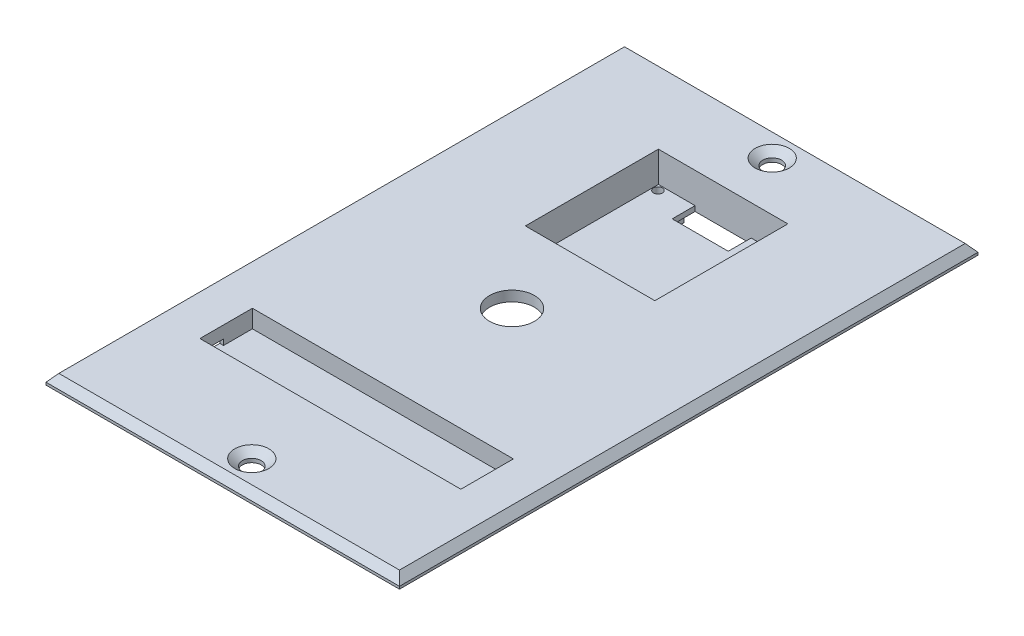
from build123d import *
from OCP.BRepFilletAPI import BRepFilletAPI_MakeChamfer

# Parameters (mm, degrees)
SKETCH2_W                = 69.35
SKETCH2_H                = 113.5
SKETCH2_R                = 1.85
BOSS_EXTRUDE3_DEPTH      = 2
SKETCH4_W                = 25.4
SKETCH4_H                = 26.1
CUT_EXTRUDE7_DEPTH       = 7.5
SKETCH16_W               = 29.414133621
SKETCH16_H               = 29.490350257
BOSS_EXTRUDE18_DEPTH     = 5
SKETCH17_W               = 25.4
SKETCH17_H               = 26.1
CUT_EXTRUDE8_DEPTH       = 4
SKETCH18_W               = 5
SKETCH18_H               = 5
BOSS_EXTRUDE24_DEPTH     = 4
SKETCH20_R               = 0.875
CUT_EXTRUDE10_DEPTH      = 4
SKETCH24_W               = 11
SKETCH24_H               = 4.5
CUT_EXTRUDE11_DEPTH      = 4
CHAMFER1_SIZE            = 1.5
CHAMFER1_SIZE2           = 1.258649447
SKETCH25_R               = 4.4
CUT_EXTRUDE12_DEPTH      = 4
SKETCH26_W               = 51.2
SKETCH26_H               = 10.3
CUT_EXTRUDE13_DEPTH      = 4
SKETCH27_W               = 52.651978828
SKETCH27_H               = 11.660574528
BOSS_EXTRUDE30_DEPTH     = 3
SKETCH30_W               = 51.2
SKETCH30_H               = 10.3
CUT_EXTRUDE14_DEPTH      = 3
SKETCH31_W               = 51.2
SKETCH31_H               = 10.3
BOSS_EXTRUDE31_DEPTH     = 1.5
SKETCH32_W               = 11.249454003
SKETCH32_H               = 2.603694337
CUT_EXTRUDE15_DEPTH      = 1.5
SKETCH33_W               = 1.5
SKETCH33_H               = 11.249454003
CUT_EXTRUDE16_DEPTH      = 1.5
SKETCH34_R               = 0.991075147
CUT_EXTRUDE17_DEPTH      = 1.5
SKETCH35_W               = 4.49763683
SKETCH35_H               = 1.113144729
CUT_EXTRUDE18_DEPTH      = 1.5
SKETCH36_W               = 62.277737466
SKETCH36_H               = 15.843958398
CUT_EXTRUDE19_DEPTH      = 0.5
SKETCH37_W               = 13.804637021
SKETCH37_H               = 39.531460558
CUT_EXTRUDE22_DEPTH      = 0.5
CHAMFER2_SIZE            = 1.5
CHAMFER2_SIZE2           = 1.258649447
CHAMFER3_SIZE            = 1.5
CHAMFER3_SIZE2           = 1.258649447
CUT_EXTRUDE23_DEPTH      = 67.821913509
CUT_EXTRUDE23_DEPTH_BACK = 67.821913509
SKETCH42_R               = 0.875


with BuildPart() as part:
    # Sketch2 → Boss-Extrude3 (new body)
    with BuildSketch(Plane(origin=(0, 0, 0), x_dir=(1, 0, 0), z_dir=(0, 1, 0))):
        Rectangle(SKETCH2_W, SKETCH2_H)
        with Locations(Location((0, 51.050462441, 0), (0, 0, 270))):
            Circle(SKETCH2_R, mode=Mode.SUBTRACT)
        with Locations(Location((0, -51.050462441, 0), (0, 0, 90))):
            Circle(SKETCH2_R, mode=Mode.SUBTRACT)
    extrude(amount=BOSS_EXTRUDE3_DEPTH)

    # Sketch4 → Cut-Extrude7 (cut)
    with BuildSketch(Plane(origin=(0, 2, 0), x_dir=(1, 0, 0), z_dir=(0, 1, 0))):
        with Locations((0, 28.375)):
            Rectangle(SKETCH4_W, SKETCH4_H)
    extrude(amount=-CUT_EXTRUDE7_DEPTH, mode=Mode.SUBTRACT)

    # Sketch16 → Boss-Extrude18 (add)
    with BuildSketch(Plane(origin=(0, 0, 0), x_dir=(-1, 0, 0), z_dir=(0, -1, 0))):
        with Locations((-0.116069165, 28.233366211)):
            Rectangle(SKETCH16_W, SKETCH16_H)
    extrude(amount=BOSS_EXTRUDE18_DEPTH)

    # Sketch17 → Cut-Extrude8 (cut)
    with BuildSketch(Plane(origin=(0, 0, 0), x_dir=(1, 0, 0), z_dir=(0, 1, 0))):
        with Locations((0, 28.375)):
            Rectangle(SKETCH17_W, SKETCH17_H)
    extrude(amount=-CUT_EXTRUDE8_DEPTH, mode=Mode.SUBTRACT)

    # Sketch18 → Boss-Extrude24 (add)
    with BuildSketch(Plane(origin=(0, -4, 0), x_dir=(1, 0, 0), z_dir=(0, 1, 0))):
        with Locations((-10.2, 38.925)):
            Rectangle(SKETCH18_W, SKETCH18_H)
        with Locations((10.2, 38.925)):
            Rectangle(SKETCH18_W, SKETCH18_H)
        with Locations((10.2, 17.825)):
            Rectangle(SKETCH18_W, SKETCH18_H)
        with Locations((-10.2, 17.825)):
            Rectangle(SKETCH18_W, SKETCH18_H)
    extrude(amount=-BOSS_EXTRUDE24_DEPTH)

    # Sketch20 → Cut-Extrude10 (cut)
    with BuildSketch(Plane(origin=(0, -8, 0), x_dir=(-1, 0, 0), z_dir=(0, -1, 0))):
        with Locations(Location((-11.659970213, 40.369100554, 0), (0, 0, 90))):
            Circle(SKETCH20_R)
        with Locations(Location((11.725608978, 40.361432855, 0), (0, 0, 270))):
            Circle(SKETCH20_R)
        with Locations(Location((11.725608978, 16.657728735, 0), (0, 0, 90))):
            Circle(SKETCH20_R)
        with Locations(Location((-11.659970213, 16.657728735, 0), (0, 0, 270))):
            Circle(SKETCH20_R)
    extrude(amount=-CUT_EXTRUDE10_DEPTH, mode=Mode.SUBTRACT)

    # Sketch24 → Cut-Extrude11 (cut)
    with BuildSketch(Plane(origin=(0, -4, 0), x_dir=(1, 0, 0), z_dir=(0, 1, 0))):
        with Locations((0, 39.175)):
            Rectangle(SKETCH24_W, SKETCH24_H)
    extrude(amount=-CUT_EXTRUDE11_DEPTH, mode=Mode.SUBTRACT)

    # Chamfer1: one chamfer whose edges measure the first distance from different faces: ONE call of the kernel's chamfer builder (chamfer() names one face for all edges)
    chamfer1_edges_1 = [part.edges().sort_by_distance(p)[0] for p in [
        (-34.675, 2, 0),
    ]]
    chamfer1_side_1 = [part.faces().sort_by_distance(p)[0] for p in [
        (-34.675, 1, 0),
    ]]
    chamfer1_edges_2 = [part.edges().sort_by_distance(p)[0] for p in [
        (0, 2, 56.75),
    ]]
    chamfer1_side_2 = [part.faces().sort_by_distance(p)[0] for p in [
        (0, 1, 56.75),
    ]]
    chamfer1_edges_3 = [part.edges().sort_by_distance(p)[0] for p in [
        (34.675, 2, 0),
    ]]
    chamfer1_side_3 = [part.faces().sort_by_distance(p)[0] for p in [
        (34.675, 1, 0),
    ]]
    chamfer1_edges_4 = [part.edges().sort_by_distance(p)[0] for p in [
        (0, 2, -56.75),
    ]]
    chamfer1_side_4 = [part.faces().sort_by_distance(p)[0] for p in [
        (0, 1, -56.75),
    ]]
    chamfer1 = BRepFilletAPI_MakeChamfer(part.part.solid().wrapped)
    for e in chamfer1_edges_1:
        chamfer1.Add(CHAMFER1_SIZE, CHAMFER1_SIZE2, e.wrapped, chamfer1_side_1[0].wrapped)  # the first distance lies on this face
    for e in chamfer1_edges_2:
        chamfer1.Add(CHAMFER1_SIZE, CHAMFER1_SIZE2, e.wrapped, chamfer1_side_2[0].wrapped)  # the first distance lies on this face
    for e in chamfer1_edges_3:
        chamfer1.Add(CHAMFER1_SIZE, CHAMFER1_SIZE2, e.wrapped, chamfer1_side_3[0].wrapped)  # the first distance lies on this face
    for e in chamfer1_edges_4:
        chamfer1.Add(CHAMFER1_SIZE, CHAMFER1_SIZE2, e.wrapped, chamfer1_side_4[0].wrapped)  # the first distance lies on this face
    add(Compound.cast(chamfer1.Shape()), mode=Mode.REPLACE)

    # Sketch25 → Cut-Extrude12 (cut)
    with BuildSketch(Plane(origin=(0, 2, 0), x_dir=(1, 0, 0), z_dir=(0, 1, 0))):
        with Locations(Location((0, 0, 0), (0, 0, 270))):
            Circle(SKETCH25_R)
    extrude(amount=-CUT_EXTRUDE12_DEPTH, mode=Mode.SUBTRACT)

    # Sketch26 → Cut-Extrude13 (cut)
    with BuildSketch(Plane(origin=(0, 2, 0), x_dir=(1, 0, 0), z_dir=(0, 1, 0))):
        with Locations((0.104035738, -30.584770495)):
            Rectangle(SKETCH26_W, SKETCH26_H)
    extrude(amount=-CUT_EXTRUDE13_DEPTH, mode=Mode.SUBTRACT)

    # Sketch27 → Boss-Extrude30 (add)
    with BuildSketch(Plane(origin=(0, 0, 0), x_dir=(-1, 0, 0), z_dir=(0, -1, 0))):
        with Locations((-0.102132054, -30.545281087)):
            Rectangle(SKETCH27_W, SKETCH27_H)
    extrude(amount=BOSS_EXTRUDE30_DEPTH)

    # Sketch30 → Cut-Extrude14 (cut)
    with BuildSketch(Plane(origin=(0, 0, 0), x_dir=(1, 0, 0), z_dir=(0, 1, 0))):
        with Locations((0.104035738, -30.584770495)):
            Rectangle(SKETCH30_W, SKETCH30_H)
    extrude(amount=-CUT_EXTRUDE14_DEPTH, mode=Mode.SUBTRACT)

    # Sketch31 → Boss-Extrude31 (add)
    with BuildSketch(Plane(origin=(0, -3, 0), x_dir=(-1, 0, 0), z_dir=(0, -1, 0))):
        with Locations((-0.104035738, -30.584770495)):
            Rectangle(SKETCH31_W, SKETCH31_H)
    extrude(amount=-BOSS_EXTRUDE31_DEPTH)

    # Sketch32 → Cut-Extrude15 (cut)
    with BuildSketch(Plane(origin=(26.428121468, 0, 0), x_dir=(0, 0, -1), z_dir=(1, 0, 0))):
        with Locations((-30.572653553, -1.487745374)):
            Rectangle(SKETCH32_W, SKETCH32_H)
    extrude(amount=-CUT_EXTRUDE15_DEPTH, mode=Mode.SUBTRACT)

    # Sketch33 → Cut-Extrude16 (cut)
    with BuildSketch(Plane(origin=(0, -2.789592542, 0), x_dir=(1, 0, 0), z_dir=(0, 1, 0))):
        with Locations((25.678121468, -30.572653553)):
            Rectangle(SKETCH33_W, SKETCH33_H)
    extrude(amount=-CUT_EXTRUDE16_DEPTH, mode=Mode.SUBTRACT)

    # Sketch34 → Cut-Extrude17 (cut)
    with BuildSketch(Plane.ZY.offset(26.22385736)):
        with Locations((34.622232322, -1.377930419)):
            Circle(SKETCH34_R)
    extrude(amount=-CUT_EXTRUDE17_DEPTH, mode=Mode.SUBTRACT)

    # Sketch35 → Cut-Extrude18 (cut)
    with BuildSketch(Plane.ZY.offset(26.22385736)):
        with Locations((33.35694274, -0.943427635)):
            Rectangle(SKETCH35_W, SKETCH35_H)
    extrude(amount=-CUT_EXTRUDE18_DEPTH, mode=Mode.SUBTRACT)

    # Sketch36 → Cut-Extrude19 (cut)
    with BuildSketch(Plane(origin=(0, 0, 0), x_dir=(-1, 0, 0), z_dir=(0, -1, 0))):
        with Locations((-0.078435438, -15.373345772)):
            Rectangle(SKETCH36_W, SKETCH36_H)
    extrude(amount=-CUT_EXTRUDE19_DEPTH, mode=Mode.SUBTRACT)

    # Sketch37 → Cut-Extrude22 (cut)
    with BuildSketch(Plane(origin=(0, 0, 0), x_dir=(-1, 0, 0), z_dir=(0, -1, 0))):
        with Locations((-23.687502159, 32.707577485)):
            Rectangle(SKETCH37_W, SKETCH37_H)
    extrude(amount=-CUT_EXTRUDE22_DEPTH, mode=Mode.SUBTRACT)

    # Chamfer2
    chamfer2_edges = [part.edges().sort_by_distance(p)[0] for p in [
        (0, 2, 52.900462441),
    ]]
    chamfer2_side = [part.faces().sort_by_distance(p)[0] for p in [
        (-32.120828655, 2, 0),
    ]]
    chamfer(chamfer2_edges, length=CHAMFER2_SIZE, length2=CHAMFER2_SIZE2, reference=chamfer2_side[0])

    # Chamfer3
    chamfer3_edges = [part.edges().sort_by_distance(p)[0] for p in [
        (0, 2, -52.900462441),
    ]]
    chamfer3_side = [part.faces().sort_by_distance(p)[0] for p in [
        (0, 2, 54.53001463),
    ]]
    chamfer(chamfer3_edges, length=CHAMFER3_SIZE, length2=CHAMFER3_SIZE2, reference=chamfer3_side[0])

    # Sketch42 → Cut-Extrude23 (cut, two sides: drawn at the far end of the back side and taken through both)
    with BuildSketch(Plane(origin=(0, -1.5, 0), x_dir=(1, 0, 0), z_dir=(0, 1, 0)).offset(-CUT_EXTRUDE23_DEPTH_BACK)):
        with Locations(Location((-12.995964262, -33.234770495, 0), (0, 0, 270))):
            Circle(SKETCH42_R)
        with Locations(Location((11.754035738, -33.234770495, 0), (0, 0, 270))):
            Circle(SKETCH42_R)
    extrude(amount=CUT_EXTRUDE23_DEPTH + CUT_EXTRUDE23_DEPTH_BACK, mode=Mode.SUBTRACT)


solid = part.part
